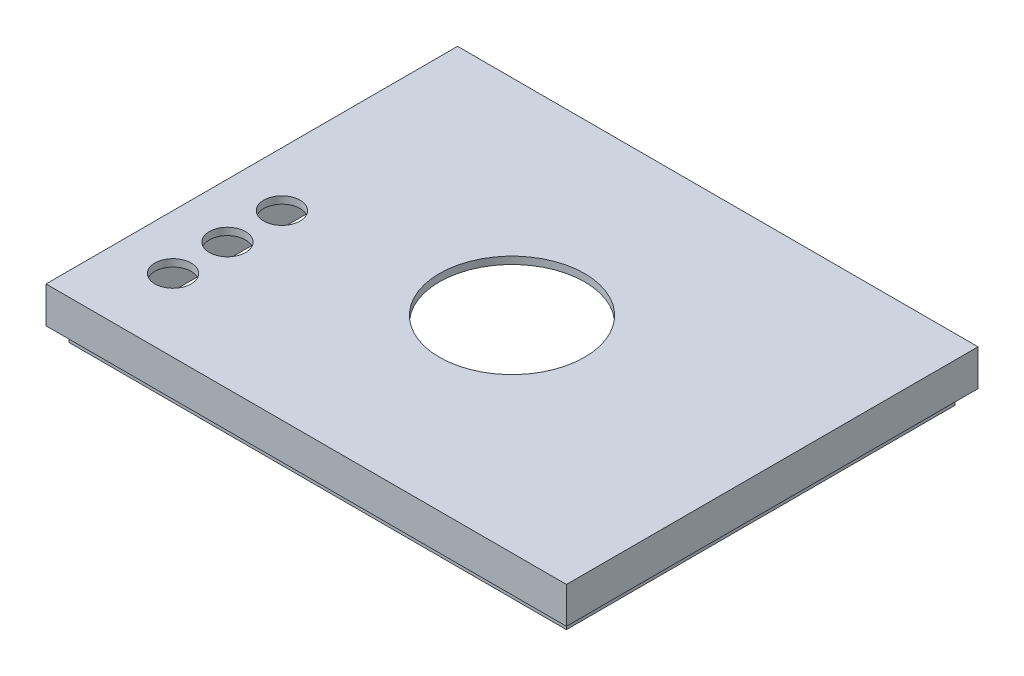
from build123d import *

# Parameters (mm, degrees)
SKETCH1_W           = 71.7
SKETCH1_H           = 56.7
BOSS_EXTRUDE1_DEPTH = 5
SKETCH2_W           = 68.5
SKETCH2_H           = 53.5
SKETCH2_W_2         = 66.5
SKETCH2_H_2         = 51.5
BOSS_EXTRUDE2_DEPTH = 2
SKETCH2_2_W         = 66.5
SKETCH2_2_H         = 51.5
CUT_EXTRUDE1_DEPTH  = 4
SKETCH3_R           = 2.5
SKETCH3_R_2         = 10
CUT_EXTRUDE2_DEPTH  = 1


with BuildPart() as part:
    # Sketch1 → Boss-Extrude1 (new body)
    with BuildSketch(Plane(origin=(0, 0, 0), x_dir=(1, 0, 0), z_dir=(0, 1, 0))):
        with Locations((11.345000373, -6.211960564)):
            Rectangle(SKETCH1_W, SKETCH1_H)
    extrude(amount=BOSS_EXTRUDE1_DEPTH)

    # Sketch2 → Boss-Extrude2 (add)
    with BuildSketch(Plane.XZ):
        with Locations((11.345000373, 6.211960564)):
            Rectangle(SKETCH2_W, SKETCH2_H)
        with Locations((11.345000373, 6.211960564)):
            Rectangle(SKETCH2_W_2, SKETCH2_H_2, mode=Mode.SUBTRACT)
    extrude(amount=BOSS_EXTRUDE2_DEPTH)

    # Sketch2<2> → Cut-Extrude1 (cut)
    with BuildSketch(Plane.XZ):
        with Locations((11.345000373, 6.211960564)):
            Rectangle(SKETCH2_2_W, SKETCH2_2_H)
    extrude(amount=-CUT_EXTRUDE1_DEPTH, mode=Mode.SUBTRACT)

    # Sketch3 → Cut-Extrude2 (cut)
    with BuildSketch(Plane(origin=(0, 5, 0), x_dir=(1, 0, 0), z_dir=(0, 1, 0))):
        with Locations((-17.004999627, -24.561960564)):
            Circle(SKETCH3_R)
        with Locations((-17.004999627, -17.061960564)):
            Circle(SKETCH3_R)
        with Locations((-17.004999627, -9.561960564)):
            Circle(SKETCH3_R)
        with Locations((11.345000373, -6.211960564)):
            Circle(SKETCH3_R_2)
    extrude(amount=-CUT_EXTRUDE2_DEPTH, mode=Mode.SUBTRACT)


solid = part.part
